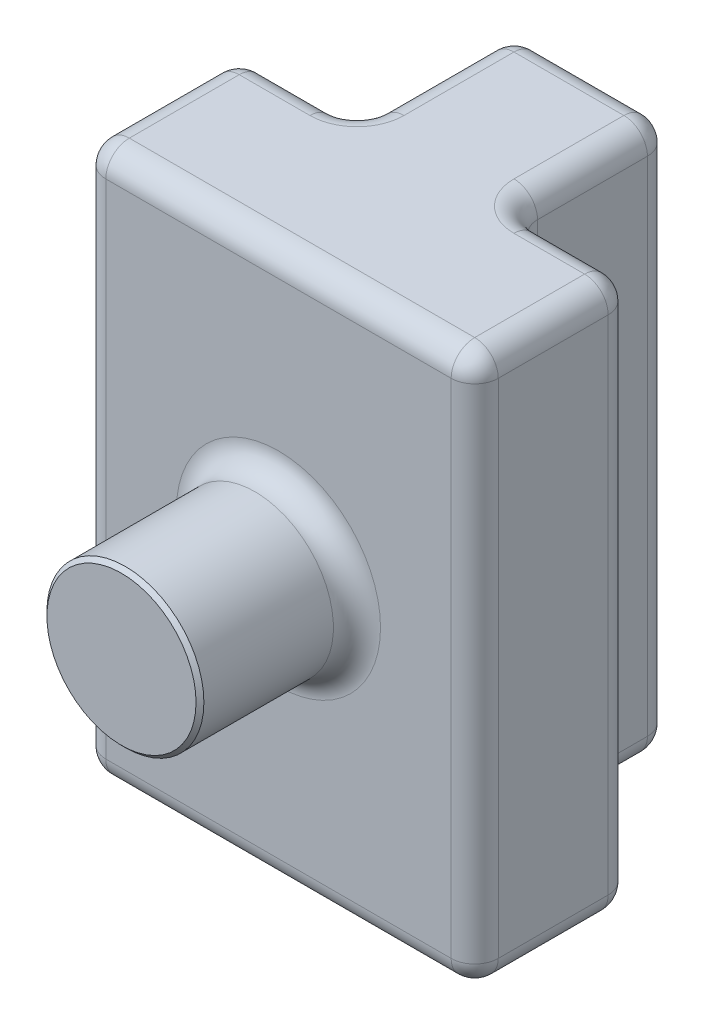
from build123d import *

# Parameters (mm, degrees)
BOSS_EXTRUDE1_DEPTH = 35
SKETCH2_R           = 10
BOSS_EXTRUDE2_DEPTH = 20
FILLET1_R           = 3
CHAMFER1_SIZE       = 0.5


with BuildPart() as part:
    # Sketch1 → Boss-Extrude1 (new, symmetric)
    with BuildSketch(Plane(origin=(0, 0, 0), x_dir=(1, 0, 0), z_dir=(0, 1, 0))):
        Polygon((25, 0), (-25, 0), (-25, 20), (-10, 20), (-10, 40), (10, 40), (10, 20), (25, 20), align=None)
    extrude(amount=BOSS_EXTRUDE1_DEPTH, both=True)

    # Sketch2 → Boss-Extrude2 (add)
    with BuildSketch(Plane.XY):
        Circle(SKETCH2_R)
    extrude(amount=BOSS_EXTRUDE2_DEPTH)

    # Fillet1
    fillet1_edges = [part.edges().sort_by_distance(p)[0] for p in [
        (25, -35, -10),
        (0, -35, 0),
        (-25, -35, -10),
        (-17.5, -35, -20),
        (0, 35, 0),
        (-10, 0, -20),
        (-10, 0, -40),
        (10, 0, -40),
        (10, 0, -20),
        (25, 0, -20),
        (25, 0, 0),
        (-25, 0, 0),
        (-25, 0, -20),
        (25, 35, -10),
        (17.5, 35, -20),
        (-10, 0, 0),
        (10, 35, -30),
        (0, 35, -40),
        (-10, 35, -30),
        (-17.5, 35, -20),
        (-10, -35, -30),
        (-25, 35, -10),
        (0, -35, -40),
        (10, -35, -30),
        (17.5, -35, -20),
    ]]
    fillet(fillet1_edges, radius=FILLET1_R)

    # Chamfer1
    chamfer1_edges = [part.edges().sort_by_distance(p)[0] for p in [
        (-10, 0, 20),
    ]]
    chamfer(chamfer1_edges, length=CHAMFER1_SIZE)


solid = part.part
